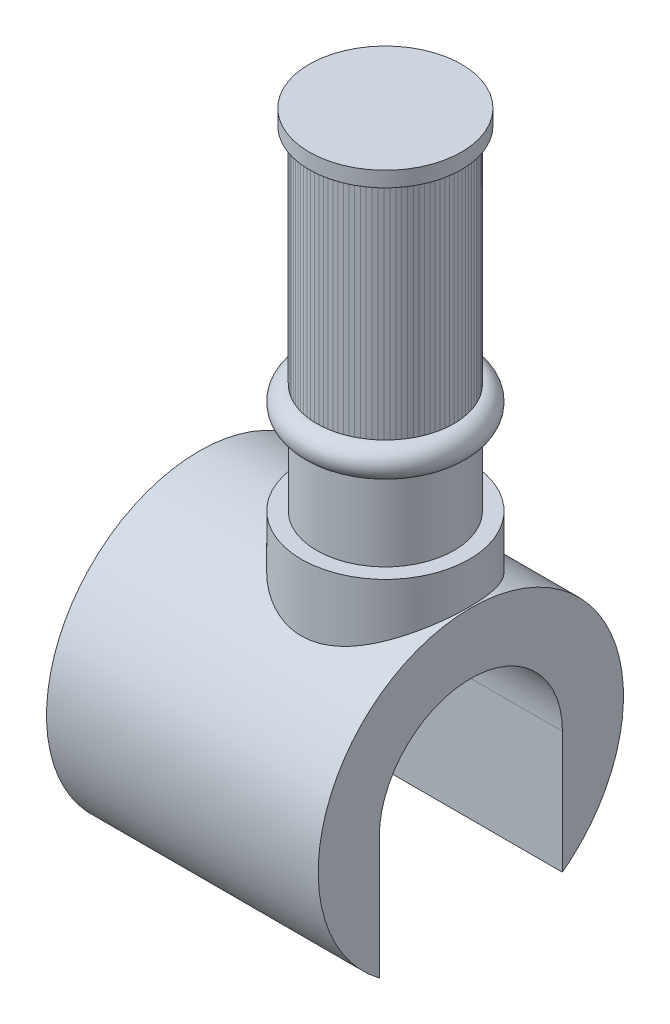
from build123d import *

# Parameters (mm, degrees)
BOSS_EXTRUDE3_DEPTH      = 1.4
BOSS_EXTRUDE3_DEPTH_BACK = 3.05
SKETCH6_R                = 2.5
CUT_EXTRUDE1_DEPTH       = 4.45
SKETCH2_R                = 1.125
BOSS_EXTRUDE1_DEPTH      = 3.85
SKETCH3_R                = 1.246833692
BOSS_EXTRUDE2_DEPTH      = 0.25


with BuildPart() as part:
    # Sketch4 → Revolve1 (revolve)
    with BuildSketch(Plane.XY, mode=Mode.PRIVATE) as revolve1_sk:
        with BuildLine():
            Line((0, 3.787270611), (1.125, 3.787270611))
            Line((1.125, 3.787270611), (1.125, 0.187270611))
            ThreePointArc((1.125, 0.187270611), (1.375, -0.062729389), (1.125, -0.312729389))
            Line((1.125, -0.312729389), (1.125, -1.612729389))
            Line((1.125, -1.612729389), (1.375, -1.612729389))
            Line((1.375, -1.612729389), (1.375, -2.712729389))
            Line((1.375, -2.712729389), (0, -2.712729389))
            Line((0, -2.712729389), (0, 3.787270611))
        make_face()
    revolve(revolve1_sk.sketch.rotate(Axis((0, 4.060864589, 0), (0, -1, 0)), 90), axis=Axis((0, 4.060864589, 0), (0, -1, 0)))

    # Sketch6 → Boss-Extrude3 (add, two sides: drawn at the far end of the back side and taken through both)
    with BuildSketch(Plane(origin=(0, 0, 0), x_dir=(0, 0, -1), z_dir=(1, 0, 0)).offset(-BOSS_EXTRUDE3_DEPTH_BACK)):
        with Locations((0, -4.789190855)):
            Circle(SKETCH6_R)
    extrude(amount=BOSS_EXTRUDE3_DEPTH + BOSS_EXTRUDE3_DEPTH_BACK)

    # Sketch7 → Cut-Extrude1 (cut)
    with BuildSketch(Plane.ZY.offset(3.05)):
        with BuildLine():
            Line((-1.5, -4.789190855), (-1.5, -7.570753065))
            Line((-1.5, -7.570753065), (1.5, -7.570753065))
            Line((1.5, -7.570753065), (1.5, -4.789190855))
            ThreePointArc((1.5, -4.789190855), (0, -3.289190855), (-1.5, -4.789190855))
        make_face()
    extrude(amount=-CUT_EXTRUDE1_DEPTH, mode=Mode.SUBTRACT)


with BuildPart() as body_2:
    # Sketch2 → Boss-Extrude1 (new body)
    with BuildSketch(Plane(origin=(0, 0, 0), x_dir=(1, 0, 0), z_dir=(0, 1, 0))):
        with Locations(Location((0, 0, 0), (0, 0, 90))):
            Circle(SKETCH2_R)
    extrude(amount=BOSS_EXTRUDE1_DEPTH)

    # Sketch3 → Boss-Extrude2 (add)
    with BuildSketch(Plane(origin=(0, 3.85, 0), x_dir=(1, 0, 0), z_dir=(0, 1, 0))):
        with Locations(Location((0, 0, 0), (0, 0, 270))):
            Circle(SKETCH3_R)
    extrude(amount=BOSS_EXTRUDE2_DEPTH)


solid = Compound([part.part, body_2.part])
